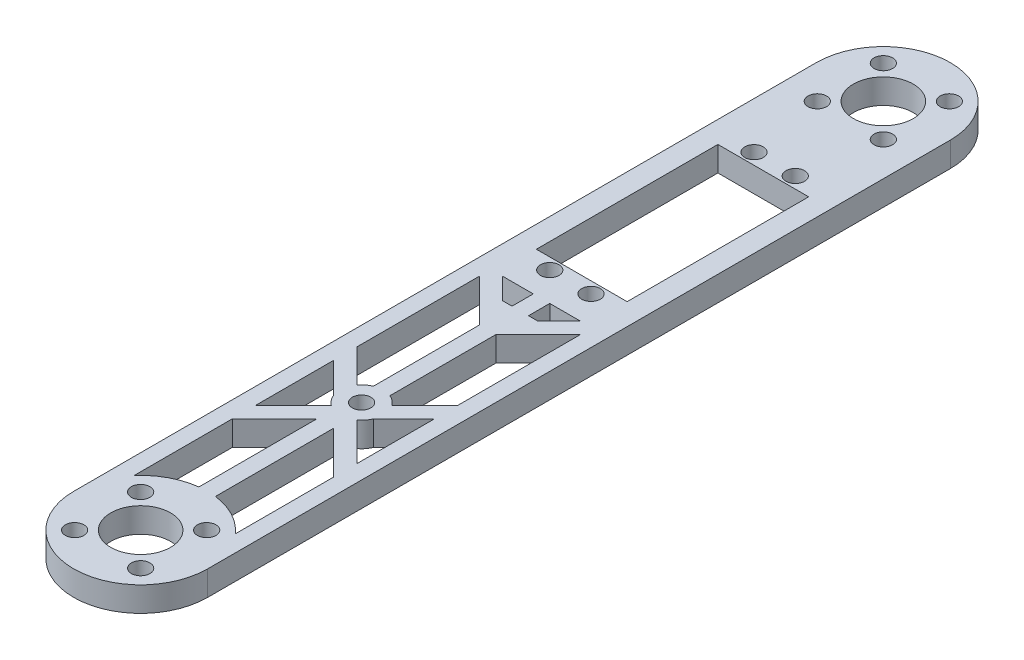
from build123d import *

# Parameters (mm, degrees)
SKETCH2_R           = 7.25
SKETCH2_R_2         = 2.25
SKETCH2_W           = 22
SKETCH2_H           = 44
BOSS_EXTRUDE1_DEPTH = 6
CUT_EXTRUDE1_START  = -26
CUT_EXTRUDE1_DEPTH  = 26


with BuildPart() as part:
    # Sketch2 → Boss-Extrude1 (new body)
    with BuildSketch(Plane(origin=(0, 0, 0), x_dir=(1, 0, 0), z_dir=(0, 1, 0))):
        with BuildLine():
            Line((-16.25, 90), (-16.25, -90))
            ThreePointArc((-16.25, -90), (0, -106.25), (16.25, -90))
            Line((16.25, -90), (16.25, 90))
            ThreePointArc((16.25, 90), (0, 106.25), (-16.25, 90))
        make_face()
        with Locations(Location((0, 90, 0), (0, 0, 270))):
            Circle(SKETCH2_R, mode=Mode.SUBTRACT)
        with Locations(Location((0, -90, 0), (0, 0, 270))):
            Circle(SKETCH2_R, mode=Mode.SUBTRACT)
        with Locations(Location((8, 98, 0), (0, 0, 270))):
            Circle(SKETCH2_R_2, mode=Mode.SUBTRACT)
        with Locations(Location((-8, 98, 0), (0, 0, 270))):
            Circle(SKETCH2_R_2, mode=Mode.SUBTRACT)
        with Locations(Location((-8, 82, 0), (0, 0, 270))):
            Circle(SKETCH2_R_2, mode=Mode.SUBTRACT)
        with Locations(Location((8, 82, 0), (0, 0, 270))):
            Circle(SKETCH2_R_2, mode=Mode.SUBTRACT)
        with Locations(Location((8, -98, 0), (0, 0, 90))):
            Circle(SKETCH2_R_2, mode=Mode.SUBTRACT)
        with Locations(Location((8, -82, 0), (0, 0, 90))):
            Circle(SKETCH2_R_2, mode=Mode.SUBTRACT)
        with Locations(Location((-8, -82, 0), (0, 0, 90))):
            Circle(SKETCH2_R_2, mode=Mode.SUBTRACT)
        with Locations(Location((-8, -98, 0), (0, 0, 90))):
            Circle(SKETCH2_R_2, mode=Mode.SUBTRACT)
        with Locations(Location((-5, 63.652785483, 0), (0, 0, 270))):
            Circle(SKETCH2_R_2, mode=Mode.SUBTRACT)
        with Locations(Location((5, 63.652785483, 0), (0, 0, 270))):
            Circle(SKETCH2_R_2, mode=Mode.SUBTRACT)
        with Locations(Location((-5, 14.152785483, 0), (0, 0, 270))):
            Circle(SKETCH2_R_2, mode=Mode.SUBTRACT)
        with Locations(Location((5, 14.152785483, 0), (0, 0, 270))):
            Circle(SKETCH2_R_2, mode=Mode.SUBTRACT)
        with Locations(Location((0, -36.453, 0), (0, 0, 270))):
            Circle(SKETCH2_R_2, mode=Mode.SUBTRACT)
        with Locations((0, 38.902785483)):
            Rectangle(SKETCH2_W, SKETCH2_H, mode=Mode.SUBTRACT)
    extrude(amount=BOSS_EXTRUDE1_DEPTH)

    # Sketch3 → Cut-Extrude1 (cut)
    with BuildSketch(Plane(origin=(0, 6, 0), x_dir=(1, 0, 0), z_dir=(0, 1, 0)).offset(CUT_EXTRUDE1_START)):
        with BuildLine():
            ThreePointArc((-2, -31.59887804), (-3.249097876, -32.329183443), (-4.25140088, -33.372725571))
            Line((-4.25140088, -33.372725571), (-12.25, -25.374126452))
            Line((-12.25, -25.374126452), (-12.25, 4.324358358))
            Line((-12.25, 4.324358358), (-2, -5.925641642))
            Line((-2, -5.925641642), (-2, -31.59887804))
        make_face()
        with BuildLine():
            ThreePointArc((4.25140088, -33.372725571), (3.249097876, -32.329183443), (2, -31.59887804))
            Line((2, -31.59887804), (2, -5.925641642))
            Line((2, -5.925641642), (12.25, 4.324358358))
            Line((12.25, 4.324358358), (12.25, -25.374126452))
            Line((12.25, -25.374126452), (4.25140088, -33.372725571))
        make_face()
        with BuildLine():
            ThreePointArc((-4.872043809, -38.408936892), (-4.138493695, -39.68338232), (-3.080274429, -40.70440088))
            Line((-3.080274429, -40.70440088), (-12.25, -49.874126451))
            Line((-12.25, -49.874126451), (-12.25, -31.030980701))
            Line((-12.25, -31.030980701), (-4.872043809, -38.408936892))
        make_face()
        with BuildLine():
            ThreePointArc((3.080274429, -40.70440088), (4.138493696, -39.68338232), (4.872043809, -38.408936892))
            Line((4.872043809, -38.408936892), (12.25, -31.030980701))
            Line((12.25, -31.030980701), (12.25, -49.874126451))
            Line((12.25, -49.874126451), (3.080274429, -40.70440088))
        make_face()
        with BuildLine():
            Line((-12.25, -55.530980701), (-12.25, -79.322921748))
            ThreePointArc((-12.25, -79.322921748), (-7.628207354, -75.651726495), (-2, -73.873546577))
            Line((-2, -73.873546577), (-2, -45.280980701))
            Line((-2, -45.280980701), (-12.25, -55.530980701))
        make_face()
        with BuildLine():
            ThreePointArc((12.25, -79.322921748), (7.628207354, -75.651726495), (2, -73.873546577))
            Line((2, -73.873546577), (2, -45.280980701))
            Line((2, -45.280980701), (12.25, -55.530980701))
            Line((12.25, -55.530980701), (12.25, -79.322921748))
        make_face()
        Polygon((-4.268787392, 2), (-9.421572875, 7.152785483), (-2, 7.152785483), (-2, 2), align=None)
        Polygon((2, 2), (4.268787392, 2), (9.421572875, 7.152785483), (2, 7.152785483), align=None)
    extrude(amount=CUT_EXTRUDE1_DEPTH, mode=Mode.SUBTRACT)


solid = part.part
